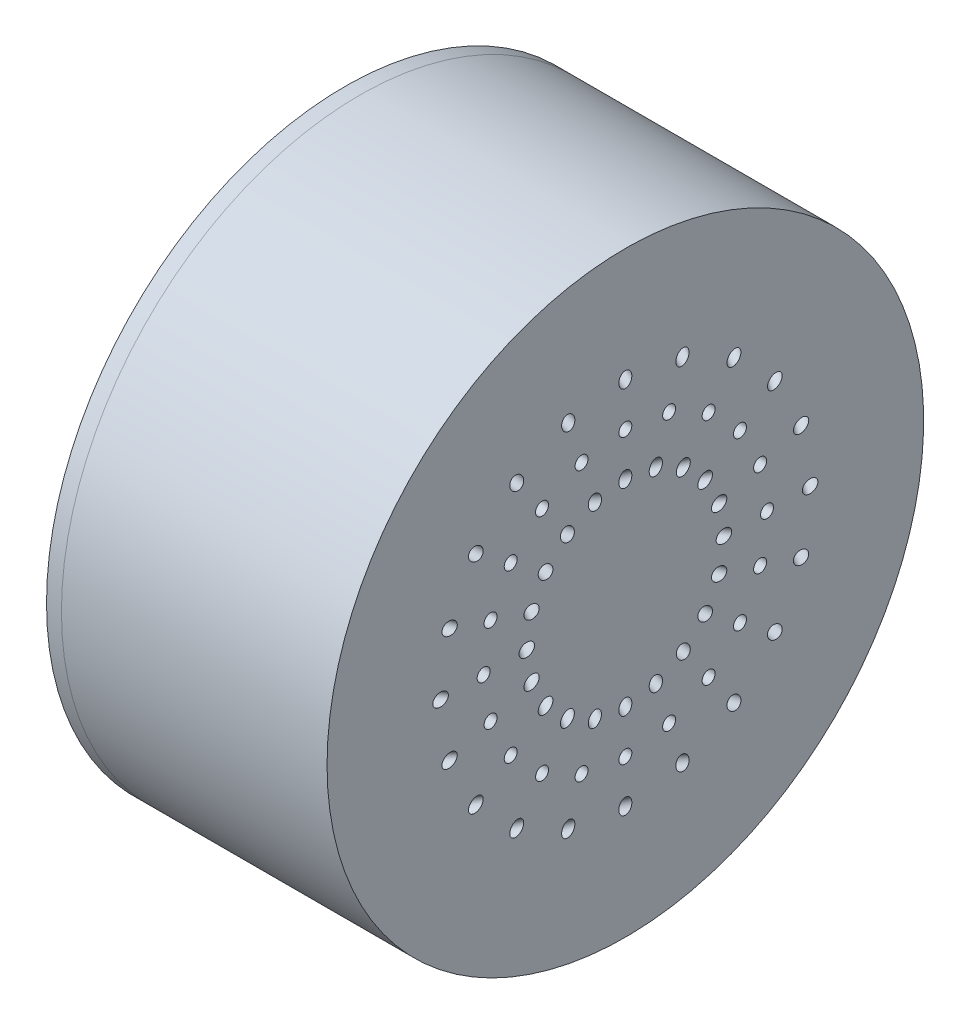
from build123d import *

# Parameters (mm, degrees)
SKETCH3_W          = 17.67078
SKETCH3_H          = 1.1049
SKETCH3_13_W       = 2.54
SKETCH3_13_H       = 50.8
CUT_EXTRUDE2_START = -21.948363
SKETCH5_R          = 1.104392
CUT_EXTRUDE2_DEPTH = 22.682036
SKETCH7_R          = 1.1049
CUT_EXTRUDE3_DEPTH = 87.27416694
CUT_EXTRUDE4_START = -21.948363
SKETCH6_R          = 1.104392
CUT_EXTRUDE4_DEPTH = 22.682036
CIRPATTERN1_COUNT  = 20


with BuildPart() as part:
    # Sketch3 → Revolve1 (revolve)
    with BuildSketch(Plane.XY, mode=Mode.PRIVATE) as revolve1_sk:
        Polygon((0, 0), (0, 15.467389906), (-17.67078, 3.728284279), (-17.67078, 0), align=None)
        Polygon((-17.67078, 18.6182), (-45.22978, 18.6182), (-45.22978, 16.0782), (-17.67078, 16.0782), (-17.67078, 6.380044279), (0, 18.119149906), (0, 23.0251), (-17.67078, 23.0251), align=None)
        Polygon((0, 25.2349), (0, 30.140850094), (-17.67078, 41.879955721), (-17.67078, 32.1818), (-45.22978, 32.1818), (-45.22978, 29.6418), (-17.67078, 29.6418), (-17.67078, 25.2349), align=None)
        Polygon((0, 32.792610094), (0, 50.8), (-45.22978, 50.8), (-45.22978, 48.26), (-17.67078, 48.26), (-17.67078, 44.531715721), align=None)
        Polygon((0, 31.466730094), (0, 32.792610094), (-17.67078, 44.531715721), (-17.67078, 43.205835721), align=None)
        Polygon((0, 30.140850094), (0, 31.466730094), (-17.67078, 43.205835721), (-17.67078, 41.879955721), align=None)
        with Locations((-8.83539, 24.68245)):
            Rectangle(SKETCH3_W, SKETCH3_H)
        with Locations((-8.83539, 23.57755)):
            Rectangle(SKETCH3_W, SKETCH3_H)
        Polygon((0, 16.793269906), (0, 18.119149906), (-17.67078, 6.380044279), (-17.67078, 5.054164279), align=None)
        Polygon((0, 15.467389906), (0, 16.793269906), (-17.67078, 5.054164279), (-17.67078, 3.728284279), align=None)
    revolve(revolve1_sk.sketch.rotate(Axis((-52.09557047, 0, 0), (1, 0, 0)), 90), axis=Axis((-52.09557047, 0, 0), (1, 0, 0)))

    # Sketch5 → Cut-Extrude2 (cut)
    with BuildSketch(Plane(origin=(0, 31.466730094, 0), x_dir=(0, 0, -1), z_dir=(0.8329501915708811, -0.5533479722218494, 0)).offset(CUT_EXTRUDE2_START)):
        with Locations(Location((0, 0, 0), (0, 0, 270))):
            Circle(SKETCH5_R)
    cut_extrude2 = extrude(amount=CUT_EXTRUDE2_DEPTH, mode=Mode.SUBTRACT)

    # Sketch7 → Cut-Extrude3 (cut, symmetric)
    with BuildSketch(Plane(origin=(0, 0, 0), x_dir=(0, 0, -1), z_dir=(1, 0, 0))):
        with Locations((0, 24.13)):
            Circle(SKETCH7_R)
    cut_extrude3 = extrude(amount=CUT_EXTRUDE3_DEPTH, both=True, mode=Mode.SUBTRACT)

    # Sketch6 → Cut-Extrude4 (cut)
    with BuildSketch(Plane(origin=(0, 16.793269906, 0), x_dir=(0, 0, -1), z_dir=(0.8329501915708811, 0.5533479722218493, 0)).offset(CUT_EXTRUDE4_START)):
        with Locations(Location((0, 0, 0), (0, 0, 90))):
            Circle(SKETCH6_R)
    cut_extrude4 = extrude(amount=CUT_EXTRUDE4_DEPTH, mode=Mode.SUBTRACT)

    # CirPattern1: Cut-Extrude2, Cut-Extrude3, Cut-Extrude4 ×20 about axis
    cirpattern1_axis = Axis((0, 0, 0), (1, 0, 0))
    add([cut_extrude2.rotate(cirpattern1_axis, i * 360 / CIRPATTERN1_COUNT) for i in range(1, CIRPATTERN1_COUNT)], mode=Mode.SUBTRACT)
    add([cut_extrude3.rotate(cirpattern1_axis, i * 360 / CIRPATTERN1_COUNT) for i in range(1, CIRPATTERN1_COUNT)], mode=Mode.SUBTRACT)
    add([cut_extrude4.rotate(cirpattern1_axis, i * 360 / CIRPATTERN1_COUNT) for i in range(1, CIRPATTERN1_COUNT)], mode=Mode.SUBTRACT)


with BuildPart() as body_2:
    # Sketch3<13> → Revolve2 (revolve)
    with BuildSketch(Plane.XY, mode=Mode.PRIVATE) as revolve2_sk:
        with Locations((-46.49978, 25.4)):
            Rectangle(SKETCH3_13_W, SKETCH3_13_H)
    revolve(revolve2_sk.sketch.rotate(Axis((-52.09557047, 0, 0), (1, 0, 0)), 90), axis=Axis((-52.09557047, 0, 0), (1, 0, 0)))


solid = Compound([part.part, body_2.part])
